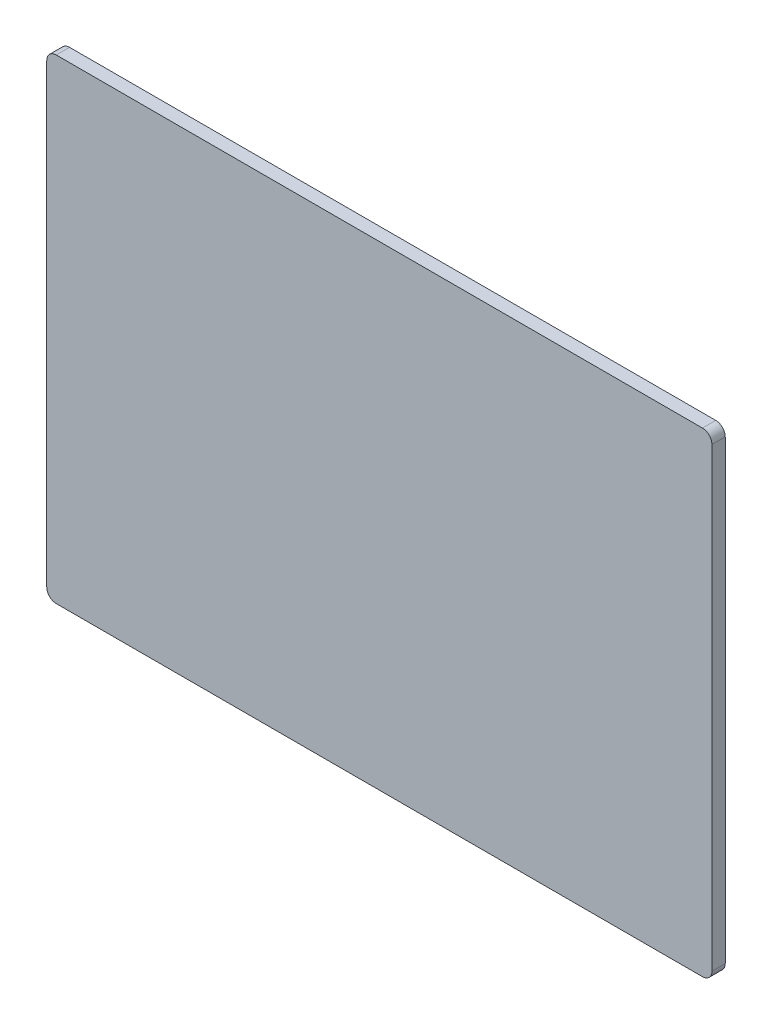
from build123d import *

# Parameters (mm, degrees)
ESQUISSE1_W        = 350
ESQUISSE1_H        = 250
BOSS_EXTRU_1_DEPTH = 7
CONG_1_R           = 5


with BuildPart() as part:
    # Esquisse1 → Boss.-Extru.1 (new body)
    with BuildSketch(Plane.XY):
        Rectangle(ESQUISSE1_W, ESQUISSE1_H)
    extrude(amount=BOSS_EXTRU_1_DEPTH)

    # Congé1
    cong_1_edges = [part.edges().sort_by_distance(p)[0] for p in [
        (-175, 125, 3.5),
        (175, 125, 3.5),
        (175, -125, 3.5),
        (-175, -125, 3.5),
    ]]
    fillet(cong_1_edges, radius=CONG_1_R)


solid = part.part
